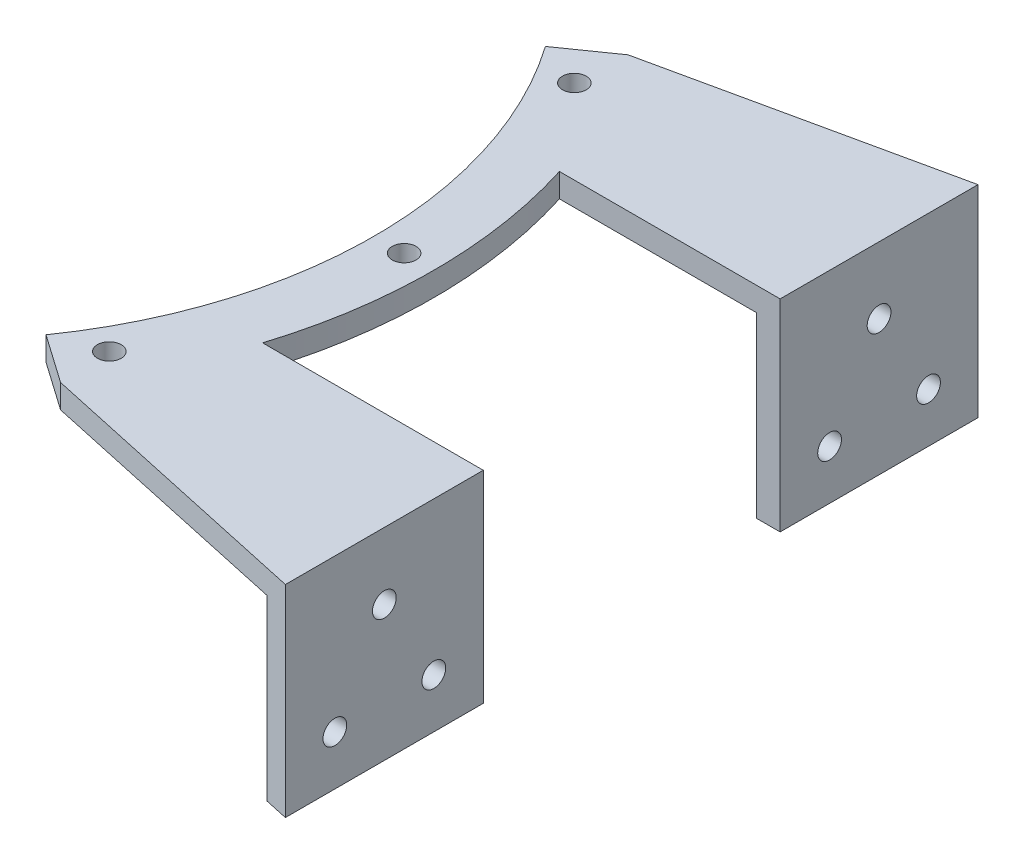
from build123d import *

# Parameters (mm, degrees)
SKETCH1_R           = 6
BOSS_EXTRUDE2_DEPTH = 12
BOSS_EXTRUDE3_DEPTH = 90
SKETCH4_R           = 6
CUT_EXTRUDE1_DEPTH  = 253.233216373


with BuildPart() as part:
    # Sketch1 → Boss-Extrude2 (new body)
    with BuildSketch(Plane(origin=(0, 0, 0), x_dir=(1, 0, 0), z_dir=(0, 1, 0))):
        with BuildLine():
            Line((350, 175), (350, 75))
            Line((350, 75), (238.484800354, 75))
            ThreePointArc((238.484800354, 75), (250, 0), (238.484800354, -75))
            Line((238.484800354, -75), (350, -75))
            Line((350, -75), (350, -175))
            Line((350, -175), (204.788011072, -143.394109088))
            Line((204.788011072, -143.394109088), (180.213449744, -126.186815997))
            ThreePointArc((180.213449744, -126.186815997), (220, 0), (180.213449744, 126.186815997))
            Line((180.213449744, 126.186815997), (204.788011072, 143.394109088))
            Line((204.788011072, 143.394109088), (350, 175))
        make_face()
        with Locations(Location((203.515969889, -117.5, 0), (0, 0, 270))):
            Circle(SKETCH1_R, mode=Mode.SUBTRACT)
        with Locations(Location((235, 0, 0), (0, 0, 270))):
            Circle(SKETCH1_R, mode=Mode.SUBTRACT)
        with Locations(Location((203.515969889, 117.5, 0), (0, 0, 270))):
            Circle(SKETCH1_R, mode=Mode.SUBTRACT)
    extrude(amount=BOSS_EXTRUDE2_DEPTH)

    # Sketch2 → Boss-Extrude3 (add)
    with BuildSketch(Plane(origin=(0, 0, 0), x_dir=(-1, 0, 0), z_dir=(0, -1, 0))):
        Polygon((-350, -175), (-350, -75), (-338, -75), (-338, -172.388158555), align=None)
        Polygon((-350, 75), (-350, 175), (-338, 172.388158555), (-338, 75), align=None)
    extrude(amount=BOSS_EXTRUDE3_DEPTH)

    # Sketch4 → Cut-Extrude1 (cut, through all)
    with BuildSketch(Plane.ZY.offset(-338)):
        with Locations((-150, -65)):
            Circle(SKETCH4_R)
        with Locations((-100, -65)):
            Circle(SKETCH4_R)
        with Locations((-125, -21.698729811)):
            Circle(SKETCH4_R)
        with Locations(Location((150, -65, 0), (0, 0, 180))):
            Circle(SKETCH4_R)
        with Locations(Location((125, -21.698729811, 0), (0, 0, 180))):
            Circle(SKETCH4_R)
        with Locations(Location((100, -65, 0), (0, 0, 180))):
            Circle(SKETCH4_R)
    extrude(amount=-CUT_EXTRUDE1_DEPTH, mode=Mode.SUBTRACT)


solid = part.part
